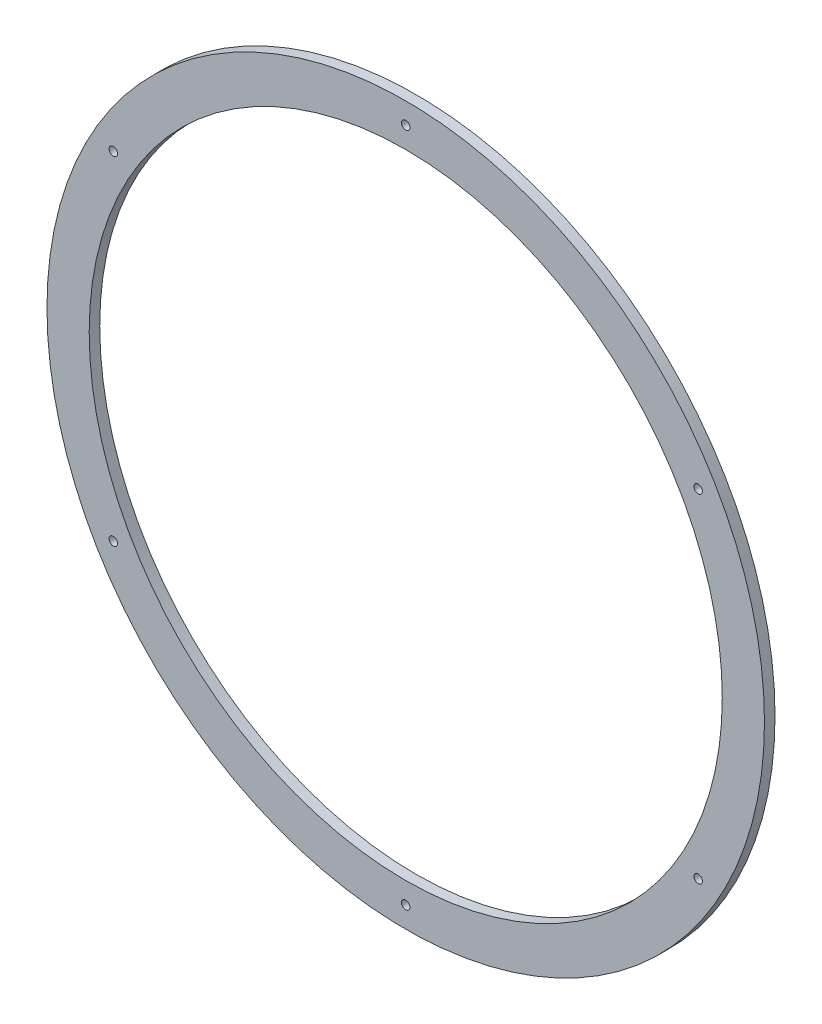
from build123d import *

# Parameters (mm, degrees)
ESQUISSE1_R             = 170
ESQUISSE1_R_2           = 150
BOSS_EXTRU_1_DEPTH      = 5
ESQUISSE2_R             = 2
ENL_V_MAT_EXTRU_1_DEPTH = 5


with BuildPart() as part:
    # Esquisse1 → Boss.-Extru.1 (new body)
    with BuildSketch(Plane.XY):
        Circle(ESQUISSE1_R)
        Circle(ESQUISSE1_R_2, mode=Mode.SUBTRACT)
    extrude(amount=BOSS_EXTRU_1_DEPTH)

    # Esquisse2 → Enlèv. mat.-Extru.1 (cut)
    with BuildSketch(Plane.XY.offset(5)):
        with Locations((0, 160)):
            Circle(ESQUISSE2_R)
        with Locations((138.564064606, 80)):
            Circle(ESQUISSE2_R)
        with Locations((138.564064606, -80)):
            Circle(ESQUISSE2_R)
        with Locations((0, -160)):
            Circle(ESQUISSE2_R)
        with Locations((-138.564064606, -80)):
            Circle(ESQUISSE2_R)
        with Locations((-138.564064606, 80)):
            Circle(ESQUISSE2_R)
    extrude(amount=-ENL_V_MAT_EXTRU_1_DEPTH, mode=Mode.SUBTRACT)


solid = part.part
